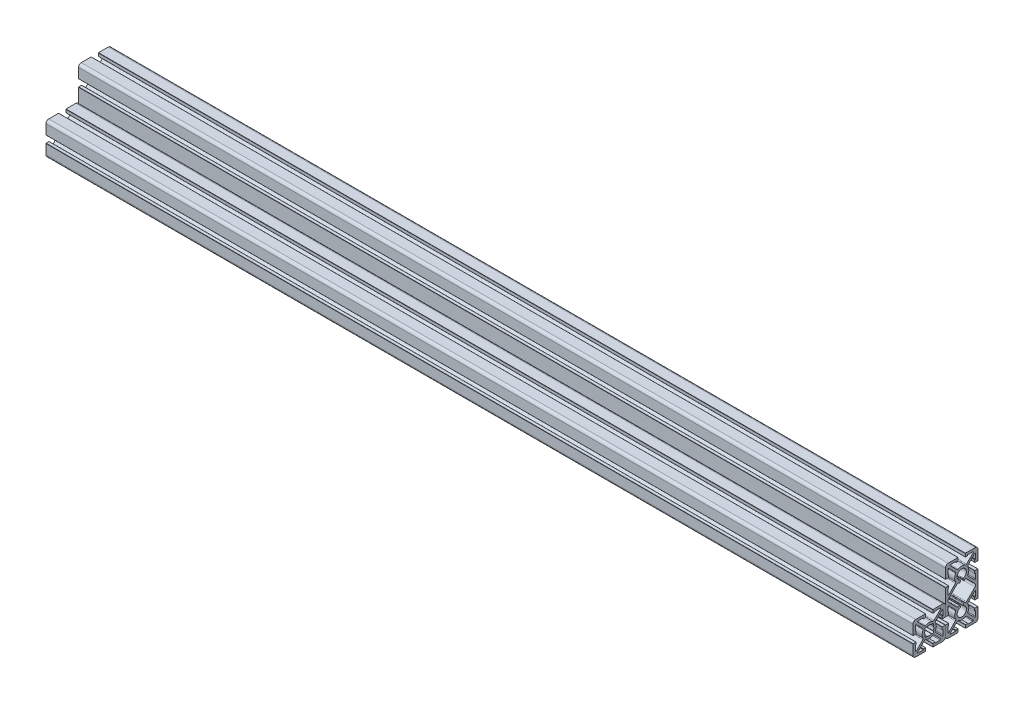
from build123d import *

# Parameters (mm, degrees)
MEMBER_1_DEPTH = 800
MEMBER_2_DEPTH = 800


with BuildPart() as part:
    # Sketch11 → Member 1 (new body)
    with BuildSketch(Plane(origin=(-400, 30.000000002, -14.999999998), x_dir=(0, 1, 0), z_dir=(1, 0, 0))):
        with BuildLine():
            Line((11.550000001, 15), (-11.549999934, 15))
            ThreePointArc((-11.549999934, 15), (-11.69142129, 14.941421357), (-11.749999934, 14.8))
            Line((-11.749999934, 14.8), (-11.749999934, 12.2))
            ThreePointArc((-11.749999934, 12.2), (-11.69142129, 12.058578644), (-11.549999934, 12))
            Line((-11.549999934, 12), (-9.549999934, 12))
            Line((-9.549999934, 12), (-9.549999934, 12.8))
            Line((-9.549999934, 12.8), (-4.821320342, 12.8))
            ThreePointArc((-4.821320342, 12.8), (-4.359380576, 12.491341716), (-4.467766951, 11.94644661))
            Line((-4.467766951, 11.94644661), (-10.595844705, 5.818368857))
            ThreePointArc((-10.595844705, 5.818368857), (-11.168394471, 5.534569785), (-11.795891287, 5.655412219))
            ThreePointArc((-11.795891287, 5.655412219), (-14.999999999, 6.5), (-18.204108709, 5.655412219))
            ThreePointArc((-18.204108709, 5.655412219), (-18.831605526, 5.534569784), (-19.404155292, 5.818368856))
            Line((-19.404155292, 5.818368856), (-25.532233046, 11.946446609))
            ThreePointArc((-25.532233046, 11.946446609), (-25.640619421, 12.491341716), (-25.178679655, 12.8))
            Line((-25.178679655, 12.8), (-20.449999933, 12.8))
            Line((-20.449999933, 12.8), (-20.449999933, 12))
            Line((-20.449999933, 12), (-18.449999934, 12))
            ThreePointArc((-18.449999934, 12), (-18.308578577, 12.058578643), (-18.249999934, 12.2))
            Line((-18.249999934, 12.2), (-18.249999934, 14.8))
            ThreePointArc((-18.249999934, 14.8), (-18.308578577, 14.941421356), (-18.449999934, 15))
            Line((-18.449999934, 15), (-27.499999998, 15))
            ThreePointArc((-27.499999998, 15), (-29.267766951, 14.267766953), (-29.999999998, 12.5))
            Line((-29.999999998, 12.5), (-29.999999998, 3.45))
            ThreePointArc((-29.999999998, 3.45), (-29.941421355, 3.308578643), (-29.799999998, 3.25))
            Line((-29.799999998, 3.25), (-27.199999933, 3.25))
            ThreePointArc((-27.199999933, 3.25), (-27.058578577, 3.308578643), (-26.999999933, 3.45))
            Line((-26.999999933, 3.45), (-26.999999933, 5.45))
            Line((-26.999999933, 5.45), (-27.799999998, 5.45))
            Line((-27.799999998, 5.45), (-27.799999998, 10.178679656))
            ThreePointArc((-27.799999998, 10.178679656), (-27.491341715, 10.640619422), (-26.946446608, 10.532233047))
            Line((-26.946446608, 10.532233047), (-20.818368855, 4.404155293))
            ThreePointArc((-20.818368855, 4.404155293), (-20.534569783, 3.831605527), (-20.655412217, 3.204108711))
            ThreePointArc((-20.655412217, 3.204108711), (-21.499999998, 0), (-20.655412217, -3.204108711))
            ThreePointArc((-20.655412217, -3.204108711), (-20.534569782, -3.831605528), (-20.818368854, -4.404155294))
            Line((-20.818368854, -4.404155294), (-26.946446607, -10.532233047))
            ThreePointArc((-26.946446607, -10.532233047), (-27.491341714, -10.640619423), (-27.799999998, -10.178679657))
            Line((-27.799999998, -10.178679657), (-27.799999998, -5.45))
            Line((-27.799999998, -5.45), (-26.999999933, -5.45))
            Line((-26.999999933, -5.45), (-26.999999933, -3.450000001))
            ThreePointArc((-26.999999933, -3.450000001), (-27.058578577, -3.308578644), (-27.199999933, -3.250000001))
            Line((-27.199999933, -3.250000001), (-29.799999998, -3.250000001))
            ThreePointArc((-29.799999998, -3.250000001), (-29.941421354, -3.308578644), (-29.999999998, -3.450000001))
            Line((-29.999999998, -3.450000001), (-29.999999998, -12.5))
            ThreePointArc((-29.999999998, -12.5), (-29.267766951, -14.267766953), (-27.499999998, -15))
            Line((-27.499999998, -15), (-18.449999933, -15))
            ThreePointArc((-18.449999933, -15), (-18.308578576, -14.941421357), (-18.249999933, -14.8))
            Line((-18.249999933, -14.8), (-18.249999933, -12.2))
            ThreePointArc((-18.249999933, -12.2), (-18.308578576, -12.058578644), (-18.449999933, -12))
            Line((-18.449999933, -12), (-20.449999933, -12))
            Line((-20.449999933, -12), (-20.449999933, -12.8))
            Line((-20.449999933, -12.8), (-25.178679654, -12.8))
            ThreePointArc((-25.178679654, -12.8), (-25.64061942, -12.491341716), (-25.532233045, -11.94644661))
            Line((-25.532233045, -11.94644661), (-19.404155291, -5.818368857))
            ThreePointArc((-19.404155291, -5.818368857), (-18.831605525, -5.534569785), (-18.204108709, -5.655412219))
            ThreePointArc((-18.204108709, -5.655412219), (-14.999999998, -6.5), (-11.795891287, -5.655412219))
            ThreePointArc((-11.795891287, -5.655412219), (-11.16839447, -5.534569784), (-10.595844704, -5.818368856))
            Line((-10.595844704, -5.818368856), (-4.467766951, -11.946446609))
            ThreePointArc((-4.467766951, -11.946446609), (-4.359380575, -12.491341716), (-4.821320341, -12.8))
            Line((-4.821320341, -12.8), (-9.549999933, -12.8))
            Line((-9.549999933, -12.8), (-9.549999933, -12))
            Line((-9.549999933, -12), (-11.549999933, -12))
            ThreePointArc((-11.549999933, -12), (-11.691421289, -12.058578643), (-11.749999933, -12.2))
            Line((-11.749999933, -12.2), (-11.749999933, -14.8))
            ThreePointArc((-11.749999933, -14.8), (-11.691421289, -14.941421356), (-11.549999933, -15))
            Line((-11.549999933, -15), (11.549999933, -15))
            ThreePointArc((11.549999933, -15), (11.691421334, -14.941421381), (11.750000002, -14.8))
            Line((11.750000002, -14.8), (11.750000002, -12.2))
            ThreePointArc((11.750000002, -12.2), (11.691421359, -12.058578643), (11.550000002, -12))
            Line((11.550000002, -12), (9.550000002, -12))
            Line((9.550000002, -12), (9.550000002, -12.799999999))
            Line((9.550000002, -12.799999999), (4.821320347, -12.799999999))
            ThreePointArc((4.821320347, -12.799999999), (4.35938058, -12.491341715), (4.467766956, -11.946446608))
            Line((4.467766956, -11.946446608), (10.595844707, -5.818368858))
            ThreePointArc((10.595844707, -5.818368858), (11.168394473, -5.534569786), (11.795891289, -5.65541222))
            ThreePointArc((11.795891289, -5.65541222), (15.000000001, -6.5), (18.204108713, -5.655412217))
            ThreePointArc((18.204108713, -5.655412217), (18.831605529, -5.534569782), (19.404155296, -5.818368854))
            Line((19.404155296, -5.818368854), (25.532233049, -11.946446607))
            ThreePointArc((25.532233049, -11.946446607), (25.640619425, -12.491341714), (25.178679659, -12.799999998))
            Line((25.178679659, -12.799999998), (20.450000002, -12.799999998))
            Line((20.450000002, -12.799999998), (20.450000002, -11.999999998))
            Line((20.450000002, -11.999999998), (18.450000002, -11.999999998))
            ThreePointArc((18.450000002, -11.999999998), (18.308578646, -12.058578641), (18.250000002, -12.199999998))
            Line((18.250000002, -12.199999998), (18.250000002, -14.799999998))
            ThreePointArc((18.250000002, -14.799999998), (18.308578646, -14.941421354), (18.450000002, -14.999999998))
            Line((18.450000002, -14.999999998), (27.500000002, -14.999999998))
            ThreePointArc((27.500000002, -14.999999998), (29.267766955, -14.26776695), (30.000000002, -12.499999998))
            Line((30.000000002, -12.499999998), (30.000000002, -3.449999997))
            ThreePointArc((30.000000002, -3.449999997), (29.941421358, -3.308578641), (29.800000002, -3.249999997))
            Line((29.800000002, -3.249999997), (27.200000002, -3.249999997))
            ThreePointArc((27.200000002, -3.249999997), (27.058578646, -3.308578641), (27.000000002, -3.449999997))
            Line((27.000000002, -3.449999997), (27.000000002, -5.449999997))
            Line((27.000000002, -5.449999997), (27.800000002, -5.449999997))
            Line((27.800000002, -5.449999997), (27.800000002, -10.178679654))
            ThreePointArc((27.800000002, -10.178679654), (27.491341718, -10.640619421), (26.946446611, -10.532233045))
            Line((26.946446611, -10.532233045), (20.818368856, -4.40415529))
            ThreePointArc((20.818368856, -4.40415529), (20.534569785, -3.831605524), (20.655412219, -3.204108708))
            ThreePointArc((20.655412219, -3.204108708), (21.499999998, 2e-09), (20.655412217, 3.204108711))
            ThreePointArc((20.655412217, 3.204108711), (20.534569782, 3.831605528), (20.818368854, 4.404155294))
            Line((20.818368854, 4.404155294), (26.94644661, 10.53223305))
            ThreePointArc((26.94644661, 10.53223305), (27.491341717, 10.640619426), (27.800000001, 10.17867966))
            Line((27.800000001, 10.17867966), (27.800000001, 5.450000003))
            Line((27.800000001, 5.450000003), (27.000000002, 5.450000003))
            Line((27.000000002, 5.450000003), (27.000000002, 3.450000003))
            ThreePointArc((27.000000002, 3.450000003), (27.058578645, 3.308578646), (27.200000002, 3.250000003))
            Line((27.200000002, 3.250000003), (29.800000002, 3.250000003))
            ThreePointArc((29.800000002, 3.250000003), (29.941421358, 3.308578646), (30.000000002, 3.450000003))
            Line((30.000000002, 3.450000003), (30.000000002, 12.500000002))
            ThreePointArc((30.000000002, 12.500000002), (29.267766955, 14.267766955), (27.500000002, 15.000000002))
            Line((27.500000002, 15.000000002), (18.450000001, 15.000000002))
            ThreePointArc((18.450000001, 15.000000002), (18.308578645, 14.941421359), (18.250000001, 14.800000002))
            Line((18.250000001, 14.800000002), (18.250000001, 12.200000002))
            ThreePointArc((18.250000001, 12.200000002), (18.308578645, 12.058578646), (18.450000001, 12.000000002))
            Line((18.450000001, 12.000000002), (20.450000001, 12.000000002))
            Line((20.450000001, 12.000000002), (20.450000001, 12.800000002))
            Line((20.450000001, 12.800000002), (25.178679659, 12.800000002))
            ThreePointArc((25.178679659, 12.800000002), (25.640619425, 12.491341718), (25.532233049, 11.946446611))
            Line((25.532233049, 11.946446611), (19.404155293, 5.818368855))
            ThreePointArc((19.404155293, 5.818368855), (18.831605527, 5.534569783), (18.20410871, 5.655412218))
            ThreePointArc((18.20410871, 5.655412218), (15.000000001, 6.5), (11.79589129, 5.655412221))
            ThreePointArc((11.79589129, 5.655412221), (11.168394474, 5.534569786), (10.595844708, 5.818368858))
            Line((10.595844708, 5.818368858), (4.467766954, 11.946446611))
            ThreePointArc((4.467766954, 11.946446611), (4.359380579, 12.491341718), (4.821320345, 12.800000002))
            Line((4.821320345, 12.800000002), (9.550000001, 12.800000002))
            Line((9.550000001, 12.800000002), (9.550000001, 12))
            Line((9.550000001, 12), (11.550000001, 12))
            ThreePointArc((11.550000001, 12), (11.691421358, 12.058578644), (11.750000001, 12.2))
            Line((11.750000001, 12.2), (11.750000001, 14.8))
            ThreePointArc((11.750000001, 14.8), (11.691421358, 14.941421357), (11.550000001, 15))
        make_face()
        with BuildLine():
            Line((-9.224603558, 1.547512825), (-10.437342234, 1.222560476))
            ThreePointArc((-10.437342234, 1.222560476), (-10.793582428, 1.259936308), (-11.033409466, 1.525994611))
            ThreePointArc((-11.033409466, 1.525994611), (-19.249999998, 0), (-11.033409466, -1.52599461))
            ThreePointArc((-11.033409466, -1.52599461), (-10.793582428, -1.259936308), (-10.437342234, -1.222560475))
            Line((-10.437342234, -1.222560475), (-9.224603557, -1.547512824))
            ThreePointArc((-9.224603557, -1.547512824), (-8.910951339, -1.798751129), (-8.88351417, -2.199682049))
            ThreePointArc((-8.88351417, -2.199682049), (-9.092664377, -2.711712717), (-9.344587779, -3.20410871))
            ThreePointArc((-9.344587779, -3.20410871), (-9.465430213, -3.831605527), (-9.181631141, -4.404155293))
            Line((-9.181631141, -4.404155293), (-1.414213571, -12.171572863))
            ThreePointArc((-1.414213571, -12.171572863), (-9e-09, -12.757359301), (1.414213554, -12.171572863))
            Line((1.414213554, -12.171572863), (9.181631135, -4.404155282))
            ThreePointArc((9.181631135, -4.404155282), (9.465430206, -3.831605516), (9.344587773, -3.204108701))
            ThreePointArc((9.344587773, -3.204108701), (9.092664372, -2.711712706), (8.883514165, -2.199682037))
            ThreePointArc((8.883514165, -2.199682037), (8.910951335, -1.798751118), (9.224603553, -1.547512813))
            Line((9.224603553, -1.547512813), (10.437342233, -1.222560463))
            ThreePointArc((10.437342233, -1.222560463), (10.793582428, -1.259936296), (11.033409466, -1.5259946))
            ThreePointArc((11.033409466, -1.5259946), (19.249999994, -1e-09), (11.033409467, 1.525994602))
            ThreePointArc((11.033409467, 1.525994602), (10.793582429, 1.259936298), (10.437342234, 1.222560465))
            Line((10.437342234, 1.222560465), (9.224603563, 1.547512813))
            ThreePointArc((9.224603563, 1.547512813), (8.910951345, 1.798751118), (8.883514176, 2.199682037))
            ThreePointArc((8.883514176, 2.199682037), (9.092664389, 2.71171272), (9.344587798, 3.204108726))
            ThreePointArc((9.344587798, 3.204108726), (9.465430235, 3.831605544), (9.181631163, 4.404155312))
            Line((9.181631163, 4.404155312), (1.414213581, 12.171572894))
            ThreePointArc((1.414213581, 12.171572894), (1.9e-08, 12.757359331), (-1.414213543, 12.171572894))
            Line((-1.414213543, 12.171572894), (-9.181631142, 4.404155295))
            ThreePointArc((-9.181631142, 4.404155295), (-9.465430214, 3.831605528), (-9.344587779, 3.204108712))
            ThreePointArc((-9.344587779, 3.204108712), (-9.092664378, 2.711712718), (-8.88351417, 2.199682049))
            ThreePointArc((-8.88351417, 2.199682049), (-8.910951339, 1.79875113), (-9.224603558, 1.547512825))
        make_face(mode=Mode.SUBTRACT)
    extrude(amount=MEMBER_1_DEPTH)


with BuildPart() as body_2:
    # Sketch12 → Member 2 (new body)
    with BuildSketch(Plane(origin=(-400, 15, 15), x_dir=(0, 1, 0), z_dir=(1, 0, 0))):
        with BuildLine():
            Line((-14.8, 3.25), (-12.2, 3.25))
            ThreePointArc((-12.2, 3.25), (-12.058578644, 3.308578644), (-12, 3.45))
            Line((-12, 3.45), (-12, 5.45))
            Line((-12, 5.45), (-12.8, 5.45))
            Line((-12.8, 5.45), (-12.8, 10.178679656))
            ThreePointArc((-12.8, 10.178679656), (-12.491341716, 10.640619423), (-11.946446609, 10.532233047))
            Line((-11.946446609, 10.532233047), (-5.818368856, 4.404155294))
            ThreePointArc((-5.818368856, 4.404155294), (-5.534569784, 3.831605527), (-5.655412219, 3.204108711))
            ThreePointArc((-5.655412219, 3.204108711), (-6.5, 0), (-5.655412219, -3.204108711))
            ThreePointArc((-5.655412219, -3.204108711), (-5.534569784, -3.831605527), (-5.818368856, -4.404155294))
            Line((-5.818368856, -4.404155294), (-11.946446609, -10.532233047))
            ThreePointArc((-11.946446609, -10.532233047), (-12.491341716, -10.640619423), (-12.8, -10.178679656))
            Line((-12.8, -10.178679656), (-12.8, -5.45))
            Line((-12.8, -5.45), (-12, -5.45))
            Line((-12, -5.45), (-12, -3.45))
            ThreePointArc((-12, -3.45), (-12.058578644, -3.308578644), (-12.2, -3.25))
            Line((-12.2, -3.25), (-14.8, -3.25))
            ThreePointArc((-14.8, -3.25), (-14.941421356, -3.308578644), (-15, -3.45))
            Line((-15, -3.45), (-15, -12.5))
            ThreePointArc((-15, -12.5), (-14.267766953, -14.267766953), (-12.5, -15))
            Line((-12.5, -15), (-3.45, -15))
            ThreePointArc((-3.45, -15), (-3.308578644, -14.941421356), (-3.25, -14.8))
            Line((-3.25, -14.8), (-3.25, -12.2))
            ThreePointArc((-3.25, -12.2), (-3.308578644, -12.058578644), (-3.45, -12))
            Line((-3.45, -12), (-5.45, -12))
            Line((-5.45, -12), (-5.45, -12.8))
            Line((-5.45, -12.8), (-10.178679656, -12.8))
            ThreePointArc((-10.178679656, -12.8), (-10.640619423, -12.491341716), (-10.532233047, -11.946446609))
            Line((-10.532233047, -11.946446609), (-4.404155294, -5.818368856))
            ThreePointArc((-4.404155294, -5.818368856), (-3.831605527, -5.534569784), (-3.204108711, -5.655412219))
            ThreePointArc((-3.204108711, -5.655412219), (0, -6.5), (3.204108711, -5.655412219))
            ThreePointArc((3.204108711, -5.655412219), (3.831605527, -5.534569784), (4.404155294, -5.818368856))
            Line((4.404155294, -5.818368856), (10.532233047, -11.946446609))
            ThreePointArc((10.532233047, -11.946446609), (10.640619423, -12.491341716), (10.178679656, -12.8))
            Line((10.178679656, -12.8), (5.45, -12.8))
            Line((5.45, -12.8), (5.45, -12))
            Line((5.45, -12), (3.45, -12))
            ThreePointArc((3.45, -12), (3.308578644, -12.058578644), (3.25, -12.2))
            Line((3.25, -12.2), (3.25, -14.8))
            ThreePointArc((3.25, -14.8), (3.308578644, -14.941421356), (3.45, -15))
            Line((3.45, -15), (12.5, -15))
            ThreePointArc((12.5, -15), (14.267766953, -14.267766953), (15, -12.5))
            Line((15, -12.5), (15, -3.45))
            ThreePointArc((15, -3.45), (14.941421356, -3.308578644), (14.8, -3.25))
            Line((14.8, -3.25), (12.2, -3.25))
            ThreePointArc((12.2, -3.25), (12.058578644, -3.308578644), (12, -3.45))
            Line((12, -3.45), (12, -5.45))
            Line((12, -5.45), (12.8, -5.45))
            Line((12.8, -5.45), (12.8, -10.178679656))
            ThreePointArc((12.8, -10.178679656), (12.491341716, -10.640619423), (11.946446609, -10.532233047))
            Line((11.946446609, -10.532233047), (5.818368856, -4.404155294))
            ThreePointArc((5.818368856, -4.404155294), (5.534569784, -3.831605527), (5.655412219, -3.204108711))
            ThreePointArc((5.655412219, -3.204108711), (6.5, 0), (5.655412219, 3.204108711))
            ThreePointArc((5.655412219, 3.204108711), (5.534569784, 3.831605527), (5.818368856, 4.404155294))
            Line((5.818368856, 4.404155294), (11.946446609, 10.532233047))
            ThreePointArc((11.946446609, 10.532233047), (12.491341716, 10.640619423), (12.8, 10.178679656))
            Line((12.8, 10.178679656), (12.8, 5.45))
            Line((12.8, 5.45), (12, 5.45))
            Line((12, 5.45), (12, 3.45))
            ThreePointArc((12, 3.45), (12.058578644, 3.308578644), (12.2, 3.25))
            Line((12.2, 3.25), (14.8, 3.25))
            ThreePointArc((14.8, 3.25), (14.941421356, 3.308578644), (15, 3.45))
            Line((15, 3.45), (15, 12.5))
            ThreePointArc((15, 12.5), (14.267766953, 14.267766953), (12.5, 15))
            Line((12.5, 15), (3.45, 15))
            ThreePointArc((3.45, 15), (3.308578644, 14.941421356), (3.25, 14.8))
            Line((3.25, 14.8), (3.25, 12.2))
            ThreePointArc((3.25, 12.2), (3.308578644, 12.058578644), (3.45, 12))
            Line((3.45, 12), (5.45, 12))
            Line((5.45, 12), (5.45, 12.8))
            Line((5.45, 12.8), (10.178679656, 12.8))
            ThreePointArc((10.178679656, 12.8), (10.640619423, 12.491341716), (10.532233047, 11.946446609))
            Line((10.532233047, 11.946446609), (4.404155294, 5.818368856))
            ThreePointArc((4.404155294, 5.818368856), (3.831605527, 5.534569784), (3.204108711, 5.655412219))
            ThreePointArc((3.204108711, 5.655412219), (0, 6.5), (-3.204108711, 5.655412219))
            ThreePointArc((-3.204108711, 5.655412219), (-3.831605527, 5.534569784), (-4.404155294, 5.818368856))
            Line((-4.404155294, 5.818368856), (-10.532233047, 11.946446609))
            ThreePointArc((-10.532233047, 11.946446609), (-10.640619423, 12.491341716), (-10.178679656, 12.8))
            Line((-10.178679656, 12.8), (-5.45, 12.8))
            Line((-5.45, 12.8), (-5.45, 12))
            Line((-5.45, 12), (-3.45, 12))
            ThreePointArc((-3.45, 12), (-3.308578644, 12.058578644), (-3.25, 12.2))
            Line((-3.25, 12.2), (-3.25, 14.8))
            ThreePointArc((-3.25, 14.8), (-3.308578644, 14.941421356), (-3.45, 15))
            Line((-3.45, 15), (-12.5, 15))
            ThreePointArc((-12.5, 15), (-14.267766953, 14.267766953), (-15, 12.5))
            Line((-15, 12.5), (-15, 3.45))
            ThreePointArc((-15, 3.45), (-14.941421356, 3.308578644), (-14.8, 3.25))
        make_face()
        with BuildLine():
            ThreePointArc((-3.77048451, -2.361507101), (-3.701606183, -2.198731495), (-3.736327923, -2.025426784))
            ThreePointArc((-3.736327923, -2.025426784), (-4.25, 0), (-3.736327923, 2.025426784))
            ThreePointArc((-3.736327923, 2.025426784), (-3.701606183, 2.198731495), (-3.77048451, 2.361507101))
            ThreePointArc((-3.77048451, 2.361507101), (-3.712310601, 3.712310601), (-2.361507101, 3.77048451))
            ThreePointArc((-2.361507101, 3.77048451), (-2.198731495, 3.701606183), (-2.025426784, 3.736327923))
            ThreePointArc((-2.025426784, 3.736327923), (0, 4.25), (2.025426784, 3.736327923))
            ThreePointArc((2.025426784, 3.736327923), (2.198731495, 3.701606183), (2.361507101, 3.77048451))
            ThreePointArc((2.361507101, 3.77048451), (3.712310601, 3.712310601), (3.77048451, 2.361507101))
            ThreePointArc((3.77048451, 2.361507101), (3.701606183, 2.198731495), (3.736327923, 2.025426784))
            ThreePointArc((3.736327923, 2.025426784), (4.25, 0), (3.736327923, -2.025426784))
            ThreePointArc((3.736327923, -2.025426784), (3.701606183, -2.198731495), (3.77048451, -2.361507101))
            ThreePointArc((3.77048451, -2.361507101), (3.712310601, -3.712310601), (2.361507101, -3.77048451))
            ThreePointArc((2.361507101, -3.77048451), (2.198731495, -3.701606183), (2.025426784, -3.736327923))
            ThreePointArc((2.025426784, -3.736327923), (0, -4.25), (-2.025426784, -3.736327923))
            ThreePointArc((-2.025426784, -3.736327923), (-2.198731495, -3.701606183), (-2.361507101, -3.77048451))
            ThreePointArc((-2.361507101, -3.77048451), (-3.712310601, -3.712310601), (-3.77048451, -2.361507101))
        make_face(mode=Mode.SUBTRACT)
    extrude(amount=MEMBER_2_DEPTH)


solid = Compound([part.part, body_2.part])
